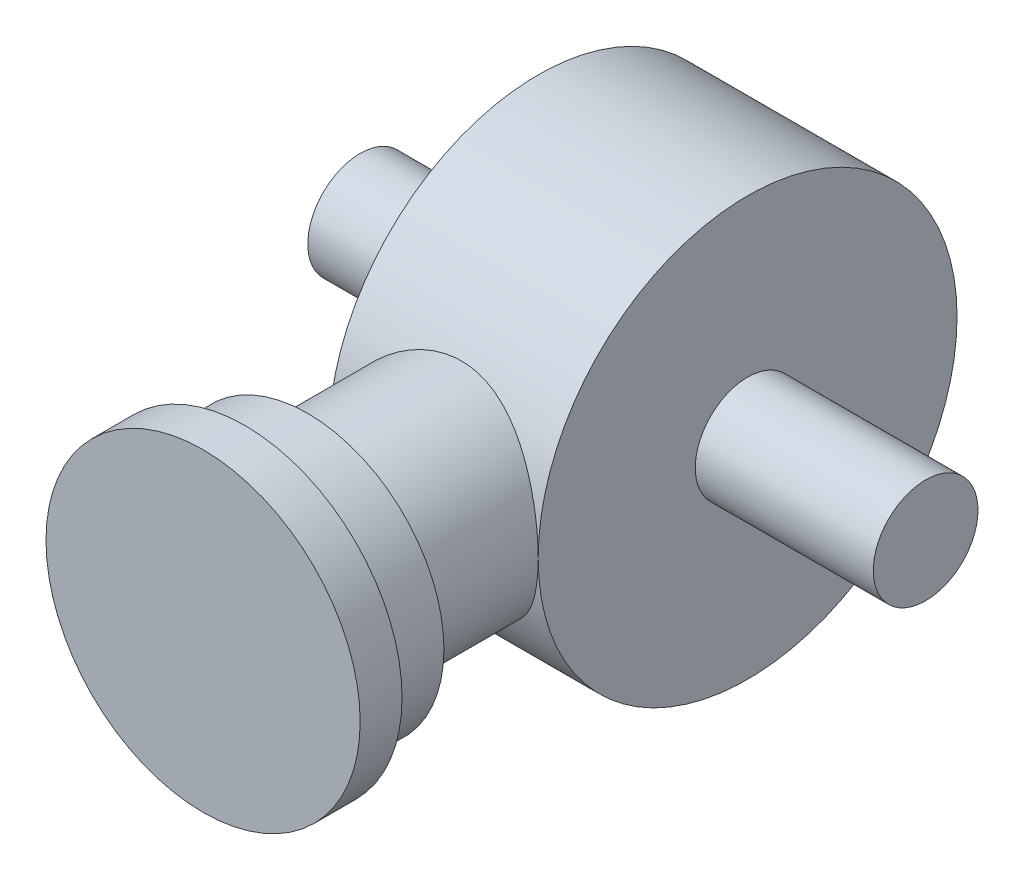
from build123d import *

# Parameters (mm, degrees)
CROQUIS1_R                   = 25.4
SALIENTE_EXTRUIR1_DEPTH      = 12.7
SALIENTE_EXTRUIR2_REACH      = 73.887
SALIENTE_EXTRUIR2_END_RADIUS = 25.4
CROQUIS2_R                   = 12.7
CROQUIS3_R                   = 16.51
SALIENTE_EXTRUIR3_DEPTH      = 7.62
CROQUIS4_R                   = 19.05
SALIENTE_EXTRUIR4_DEPTH      = 5.08
CROQUIS6_R                   = 6.35
SALIENTE_EXTRUIR5_DEPTH      = 34.29


with BuildPart() as part:
    # Croquis1 → Saliente-Extruir1 (new, symmetric)
    with BuildSketch(Plane(origin=(0, 0, 0), x_dir=(0, 0, -1), z_dir=(1, 0, 0))):
        Circle(CROQUIS1_R)
    extrude(amount=SALIENTE_EXTRUIR1_DEPTH, both=True)

    # Saliente-Extruir2: up to this cylinder (the profile starts outside it)
    saliente_extruir2_end = Plane(origin=(0, 0, 0), z_dir=(-1, 0, 0)) * Cylinder(SALIENTE_EXTRUIR2_END_RADIUS, 199.574, mode=Mode.PRIVATE)
    # Croquis2 → Saliente-Extruir2 (add, up to the surface)
    with BuildSketch(Plane.XY.offset(40.64), mode=Mode.PRIVATE) as saliente_extruir2_sk1:
        Circle(CROQUIS2_R)
    saliente_extruir2_tool1 = extrude(saliente_extruir2_sk1.sketch, amount=-SALIENTE_EXTRUIR2_REACH, mode=Mode.PRIVATE) - saliente_extruir2_end
    add(saliente_extruir2_tool1.solids().sort_by_distance((0, 0, 40.64))[0])

    # Croquis3 → Saliente-Extruir3 (add)
    with BuildSketch(Plane.XY.offset(40.64)):
        with Locations(Location((0, 0, 0), (0, 0, 180))):
            Circle(CROQUIS3_R)
    extrude(amount=SALIENTE_EXTRUIR3_DEPTH)

    # Croquis4 → Saliente-Extruir4 (add)
    with BuildSketch(Plane.XY.offset(48.26)):
        Circle(CROQUIS4_R)
    extrude(amount=SALIENTE_EXTRUIR4_DEPTH)

    # Croquis6 → Saliente-Extruir5 (add, symmetric)
    with BuildSketch(Plane(origin=(0, 0, 0), x_dir=(0, 0, -1), z_dir=(1, 0, 0))):
        Circle(CROQUIS6_R)
    extrude(amount=SALIENTE_EXTRUIR5_DEPTH, both=True)


solid = part.part
